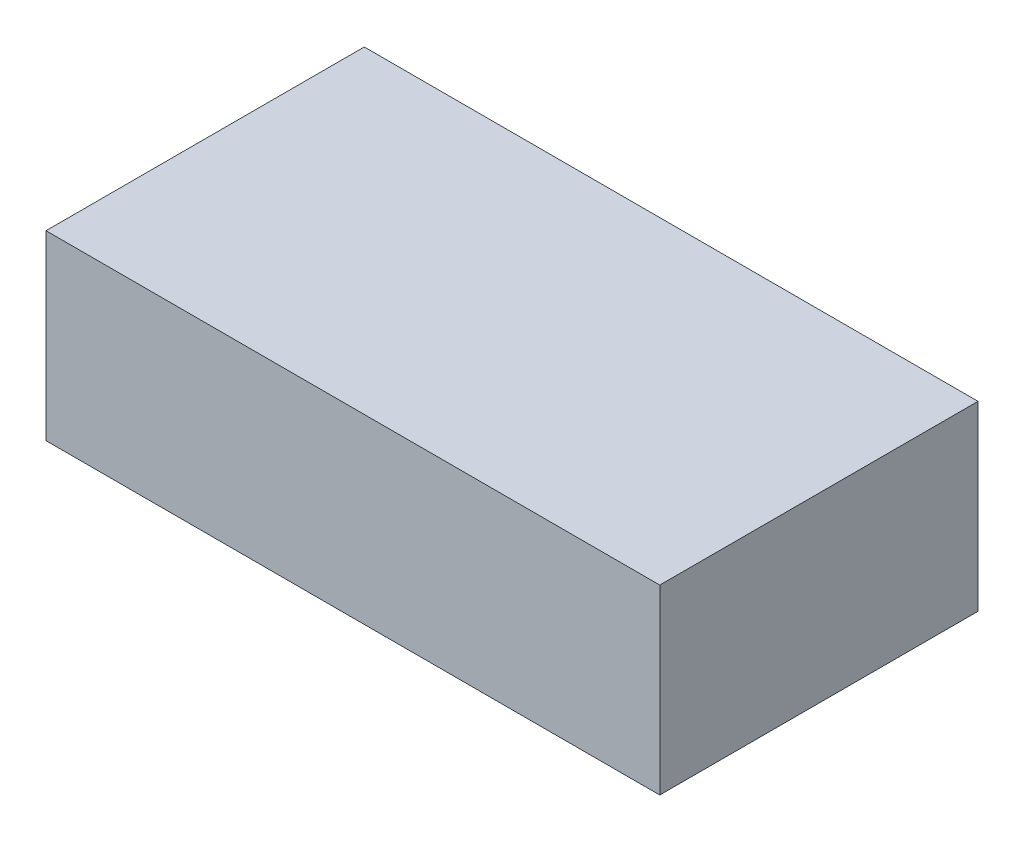
from build123d import *

# Parameters (mm, degrees)
SKETCH_1_W      = 162
SKETCH_1_H      = 84
EXTRUDE_1_DEPTH = 48


with BuildPart() as part:
    # 草图1 → 凸台-拉伸1 (new body)
    with BuildSketch(Plane(origin=(0, 0, 0), x_dir=(1, 0, 0), z_dir=(0, 1, 0))):
        with Locations((81, 42)):
            Rectangle(SKETCH_1_W, SKETCH_1_H)
    extrude(amount=EXTRUDE_1_DEPTH)


solid = part.part
